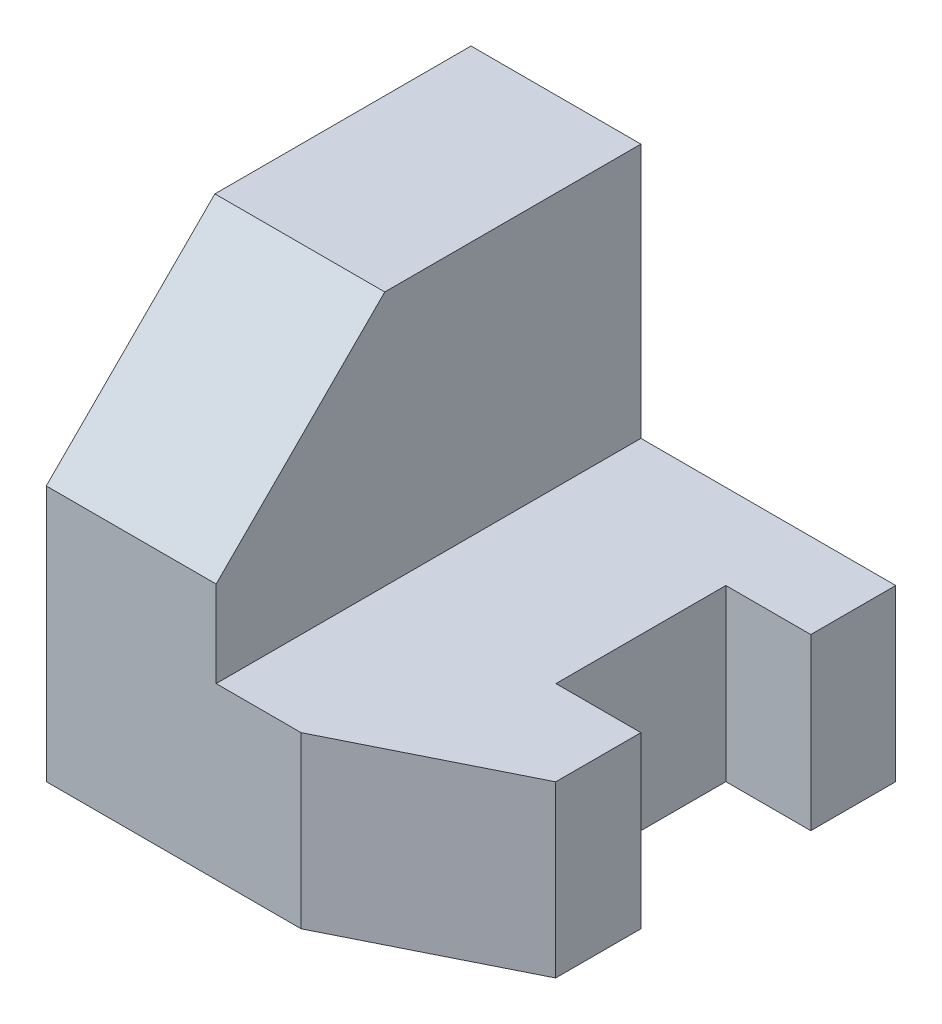
from build123d import *

# Parameters (mm, degrees)
SKETCH1_W               = 50
SKETCH1_H               = 50
BOSS_EXTRUDE1_DEPTH     = 50
CUT_EXTRUDE2_DEPTH      = 76
SKETCH4_W               = 20
SKETCH4_H               = 20
CUT_EXTRUDE3_DEPTH      = 10
CUT_EXTRUDE4_DEPTH      = 64.442887702
CUT_EXTRUDE4_DEPTH_BACK = 64.442887702
CUT_EXTRUDE5_DEPTH      = 47.368092477
CUT_EXTRUDE5_DEPTH_BACK = 47.368092477


with BuildPart() as part:
    # Sketch1 → Boss-Extrude1 (new body)
    with BuildSketch(Plane(origin=(0, 0, 0), x_dir=(1, 0, 0), z_dir=(0, 1, 0))):
        Rectangle(SKETCH1_W, SKETCH1_H)
    extrude(amount=BOSS_EXTRUDE1_DEPTH)

    # Sketch3 → Cut-Extrude2 (cut, through all)
    with BuildSketch(Plane.XY.offset(25)):
        Polygon((-5, 50), (-5, 20), (25.055791763, 20), (25, 50), align=None)
    extrude(amount=-CUT_EXTRUDE2_DEPTH, mode=Mode.SUBTRACT)

    # Sketch4 → Cut-Extrude3 (cut)
    with BuildSketch(Plane(origin=(25, 0, 0), x_dir=(0, 0, -1), z_dir=(1, 0, 0))):
        with Locations((5, 10)):
            Rectangle(SKETCH4_W, SKETCH4_H)
    extrude(amount=-CUT_EXTRUDE3_DEPTH, mode=Mode.SUBTRACT)

    # Sketch8 → Cut-Extrude4 (cut, two sides: drawn at the far end of the back side and taken through both)
    with BuildSketch(Plane(origin=(-5, 0, 0), x_dir=(0, 0, -1), z_dir=(1, 0, 0)).offset(-CUT_EXTRUDE4_DEPTH_BACK)):
        Polygon((-114.864472803, -59.71478058), (-25.149692223, 30), (-5, 50.149692223), (84.71478058, 139.864472803), (-94.71478058, 319.294033964), (-294.294033964, 119.71478058), align=None)
    extrude(amount=CUT_EXTRUDE4_DEPTH + CUT_EXTRUDE4_DEPTH_BACK, mode=Mode.SUBTRACT)

    # Sketch9 → Cut-Extrude5 (cut, two sides: drawn at the far end of the back side and taken through both)
    with BuildSketch(Plane(origin=(0, 20, 0), x_dir=(1, 0, 0), z_dir=(0, 1, 0)).offset(-CUT_EXTRUDE5_DEPTH_BACK)):
        Polygon((148.701256003, 46.638963739), (25.059091939, -15), (5, -25), (-118.642164064, -86.638963739), (4.635763413, -333.923291867), (271.97918348, -200.64536439), align=None)
    extrude(amount=CUT_EXTRUDE5_DEPTH + CUT_EXTRUDE5_DEPTH_BACK, mode=Mode.SUBTRACT)


solid = part.part
